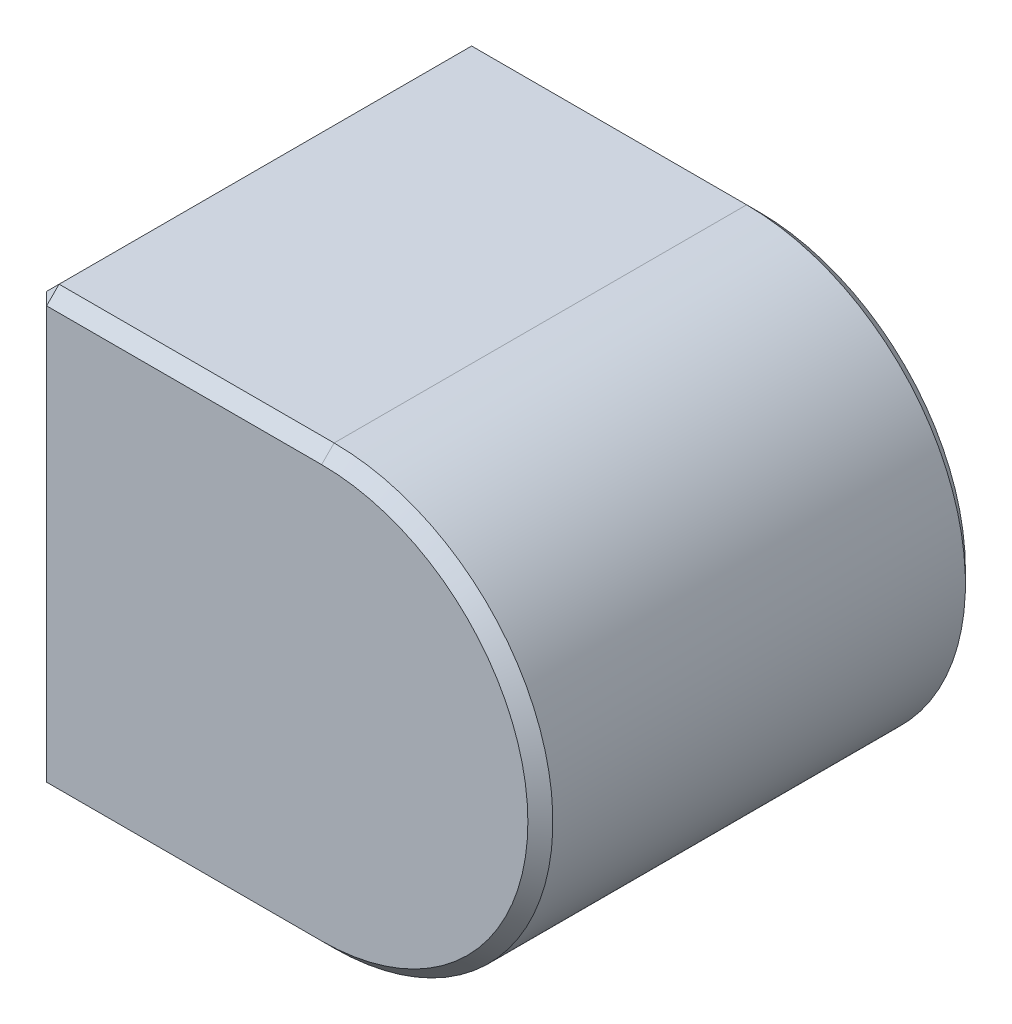
from build123d import *

# Parameters (mm, degrees)
BOSS_EXTRUDE1_DEPTH = 70
SKETCH4_R           = 25
BOSS_EXTRUDE2_DEPTH = 5
CHAMFER1_SIZE       = 2
SKETCH5_R           = 26
CUT_EXTRUDE1_DEPTH  = 5
CHAMFER3_SIZE       = 1


with BuildPart() as part:
    # Sketch3 → Boss-Extrude1 (new body)
    with BuildSketch(Plane.XY):
        with BuildLine():
            Line((0, 35), (46, 35))
            Line((46, 35), (46, -35))
            Line((46, -35), (0, -35))
            ThreePointArc((0, -35), (-35, 0), (0, 35))
        make_face()
    extrude(amount=BOSS_EXTRUDE1_DEPTH)

    # Sketch4 → Boss-Extrude2 (add)
    with BuildSketch(Plane(origin=(46, 0, 0), x_dir=(0, 0, -1), z_dir=(1, 0, 0))):
        with Locations(Location((-38, 0, 0), (0, 0, 180))):
            Circle(SKETCH4_R)
    extrude(amount=BOSS_EXTRUDE2_DEPTH)

    # Chamfer1
    chamfer1_edges = [part.edges().sort_by_distance(p)[0] for p in [
        (46, 0, 70),
        (23, 35, 70),
        (-35, 0, 70),
        (23, 35, 0),
        (46, 0, 0),
        (23, -35, 0),
        (-35, 0, 0),
        (23, -35, 70),
        (46, 35, 35),
        (46, -35, 35),
    ]]
    chamfer(chamfer1_edges, length=CHAMFER1_SIZE)

    # Sketch5 → Cut-Extrude1 (cut)
    with BuildSketch(Plane(origin=(0, 0, 0), x_dir=(-1, 0, 0), z_dir=(0, 0, -1))):
        Circle(SKETCH5_R)
    extrude(amount=-CUT_EXTRUDE1_DEPTH, mode=Mode.SUBTRACT)

    # Chamfer3
    chamfer3_edges = [part.edges().sort_by_distance(p)[0] for p in [
        (46, 0, 13),
        (51, 0, 13),
        (26, 0, 5),
        (26, 0, 0),
    ]]
    chamfer(chamfer3_edges, length=CHAMFER3_SIZE)


with BuildPart() as body_2:
    # Mirror1: mirrored copy
    add(part.part.mirror(Plane(origin=(0, 0, 0), x_dir=(0, 0, 1), z_dir=(1, 0, 0))))


solid = body_2.part
